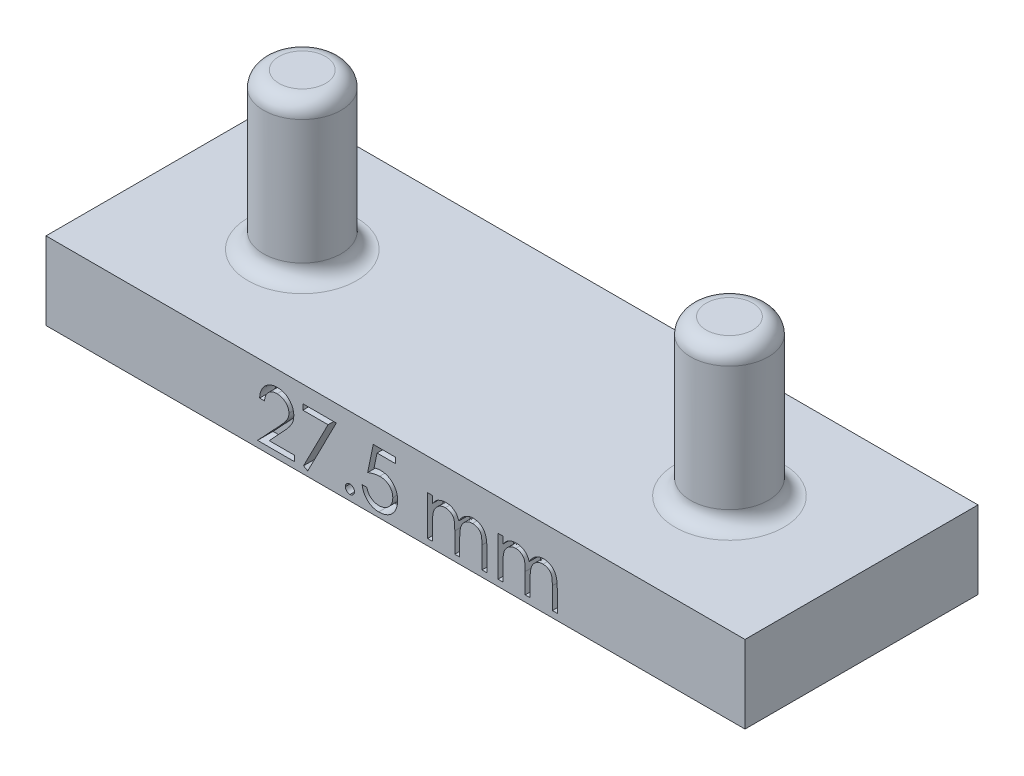
from build123d import *

# Parameters (mm, degrees)
SKETCH1_R             = 2.5
BOSS_EXTRUDE1_DEPTH   = 10
BOSS_EXTRUDE1_2_DEPTH = 10
SKETCH2_W             = 45
SKETCH2_H             = 15
BOSS_EXTRUDE2_DEPTH   = 5
CUT_EXTRUDE1_DEPTH    = 1
FILLET1_R             = 1


with BuildPart() as part:
    # Sketch1 → Boss-Extrude1 (new body)
    with BuildSketch(Plane(origin=(0, 0, 0), x_dir=(1, 0, 0), z_dir=(0, 1, 0))):
        with Locations(Location((-41.821276596, 3.10212766, 0), (0, 0, 270))):
            Circle(SKETCH1_R)
    extrude(amount=BOSS_EXTRUDE1_DEPTH)



with BuildPart() as body_2:
    # Sketch1 → Boss-Extrude1 2 (new body)
    with BuildSketch(Plane(origin=(0, 0, 0), x_dir=(1, 0, 0), z_dir=(0, 1, 0))):
        with Locations(Location((-14.321276596, 3.10212766, 0), (0, 0, 270))):
            Circle(SKETCH1_R)
    extrude(amount=BOSS_EXTRUDE1_2_DEPTH)


with BuildPart() as part_1:
    add(part.part)

    add(body_2.part)  # Boss-Extrude2 merges body 2
    # Sketch2 → Boss-Extrude2 (add)
    with BuildSketch(Plane.XZ):
        with Locations((-28.321276596, -3.10212766)):
            Rectangle(SKETCH2_W, SKETCH2_H)
    extrude(amount=BOSS_EXTRUDE2_DEPTH)

    # Sketch3 → Cut-Extrude1 (cut)
    with BuildSketch(Plane.XY.offset(4.39787234)):
        with BuildLine():
            Line((-21.721415096, -2.034062219), (-21.407312532, -2.034062219))
            Line((-21.407312532, -2.034062219), (-21.407312532, -2.478573436))
            add(Edge.make_bspline(
                [(-21.407312532, -2.478573436), (-21.379028582, -2.439685835), (-21.324833822, -2.365173462), (-21.23596817, -2.266983177), (-21.147192057, -2.183655023), (-21.083258676, -2.139912151), (-21.052544904, -2.118897956)],
                knots=[0, 0, 0, 0, 1.134379233, 2.173579362, 3.122582517, 4, 4, 4, 4], degree=3))
            add(Edge.make_bspline(
                [(-21.052544904, -2.118897956), (-21.010680241, -2.09889259), (-20.927682342, -2.059231377), (-20.796263117, -2.018997818), (-20.661788447, -1.994272717), (-20.570980233, -1.990891343), (-20.525301314, -1.989190424)],
                knots=[0, 0, 0, 0, 1.014936303, 2.012140481, 3.000054389, 4, 4, 4, 4], degree=3))
            add(Edge.make_bspline(
                [(-20.525301314, -1.989190424), (-20.494408317, -1.990235714), (-20.433272738, -1.992304289), (-20.342688648, -2.005764324), (-20.254830036, -2.029030497), (-20.170216007, -2.061437821), (-20.090495328, -2.100684508), (-20.01740613, -2.146734216), (-19.951781922, -2.198431291), (-19.893655871, -2.258110224), (-19.841386845, -2.327446823), (-19.793307998, -2.408311072), (-19.748882786, -2.502518733), (-19.724261477, -2.570885274), (-19.71129891, -2.606878725)],
                knots=[0, 0, 0, 0, 1.009824226, 1.998387844, 2.986035974, 3.974953746, 4.955485308, 5.885931332, 6.793869504, 7.679848016, 8.601185859, 9.625726857, 10.749998409, 12, 12, 12, 12], degree=3))
            add(Edge.make_bspline(
                [(-19.71129891, -2.606878725), (-19.697587659, -2.582154306), (-19.670605842, -2.533500121), (-19.625300205, -2.464641858), (-19.577832408, -2.400235067), (-19.527797915, -2.340228642), (-19.475373328, -2.284918912), (-19.420311928, -2.23412301), (-19.362927146, -2.187622797), (-19.283134906, -2.133299637), (-19.179322299, -2.075598456), (-19.048434184, -2.025570012), (-18.912284013, -1.994653883), (-18.819866315, -1.99102361), (-18.773197949, -1.989190424)],
                knots=[0, 0, 0, 0, 0.86119277, 1.694706429, 2.50939023, 3.298075842, 4.073795165, 4.829715201, 5.57930267, 6.321991688, 7.768977793, 9.186738141, 10.579381044, 12, 12, 12, 12], degree=3))
            add(Edge.make_bspline(
                [(-18.773197949, -1.989190424), (-18.730316486, -1.990807645), (-18.646393299, -1.993972703), (-18.524216034, -2.018826176), (-18.410274228, -2.061503823), (-18.304797152, -2.11973746), (-18.209637339, -2.192916643), (-18.12692103, -2.279985481), (-18.057150666, -2.380328104), (-18.011572027, -2.474720092), (-17.980656762, -2.558055425), (-17.961595528, -2.629061717), (-17.944755833, -2.707213269), (-17.930774588, -2.792603531), (-17.920556036, -2.885534139), (-17.91298532, -2.985853015), (-17.907861247, -3.093638127), (-17.907499174, -3.168003627), (-17.907312532, -3.20633786)],
                knots=[0, 0, 0, 0, 1.209669288, 2.367440248, 3.500751976, 4.631527125, 5.755587489, 6.87532382, 8.007944318, 9.190864318, 9.82315674, 10.514484317, 11.263564316, 12.079023757, 12.955305781, 13.901327259, 14.918167583, 16, 16, 16, 16], degree=3))
            Line((-17.907312532, -3.20633786), (-17.907312532, -4.591754526))
            Line((-17.907312532, -4.591754526), (-18.221415096, -4.591754526))
            Line((-18.221415096, -4.591754526), (-18.221415096, -3.204935616))
            add(Edge.make_bspline(
                [(-18.221415096, -3.204935616), (-18.221492979, -3.172215042), (-18.221642658, -3.109331075), (-18.22433629, -3.019078624), (-18.229411604, -2.936810267), (-18.235346243, -2.862638179), (-18.243590052, -2.79638939), (-18.254235984, -2.738196972), (-18.265513664, -2.68760316), (-18.284249655, -2.631517113), (-18.314197546, -2.569646902), (-18.359815026, -2.502923326), (-18.417285133, -2.444842526), (-18.483645289, -2.394424209), (-18.559193734, -2.353430568), (-18.642458457, -2.324154558), (-18.732922509, -2.30603168), (-18.795545297, -2.304225665), (-18.827885449, -2.303292988)],
                knots=[0, 0, 0, 0, 1.253487763, 2.409012846, 3.458416907, 4.410876679, 5.259312806, 6.014470957, 6.676830364, 7.243083969, 8.276244668, 9.299465089, 10.325150304, 11.392391894, 12.482080715, 13.603491619, 14.762376348, 16, 16, 16, 16], degree=3))
            add(Edge.make_bspline(
                [(-18.827885449, -2.303292988), (-18.867555403, -2.304709145), (-18.945958314, -2.307508011), (-19.0604038, -2.336081884), (-19.170374817, -2.379162134), (-19.27258995, -2.441594591), (-19.36661774, -2.516402955), (-19.447517318, -2.605352551), (-19.514349504, -2.705982478), (-19.55960348, -2.79912918), (-19.588192781, -2.882798624), (-19.607069697, -2.955895996), (-19.621753088, -3.038977564), (-19.635523617, -3.131485055), (-19.644511345, -3.234055235), (-19.652679718, -3.346213636), (-19.656500581, -3.468297596), (-19.657035039, -3.552924284), (-19.657312532, -3.596862699)],
                knots=[0, 0, 0, 0, 1.090531906, 2.155305635, 3.229839962, 4.33261226, 5.44038871, 6.529323825, 7.629011124, 8.757537029, 9.370236727, 10.061839251, 10.834451254, 11.692844982, 12.636905849, 13.66920014, 14.789842145, 16, 16, 16, 16], degree=3))
            Line((-19.657312532, -3.596862699), (-19.657312532, -4.591754526))
            Line((-19.657312532, -4.591754526), (-19.971415096, -4.591754526))
            Line((-19.971415096, -4.591754526), (-19.971415096, -3.291173597))
            add(Edge.make_bspline(
                [(-19.971415096, -3.291173597), (-19.971494527, -3.254480278), (-19.971647344, -3.183886021), (-19.974323661, -3.082652345), (-19.979410283, -2.990571265), (-19.985290832, -2.907749802), (-19.99375101, -2.834338473), (-20.003360772, -2.769943715), (-20.014709383, -2.714726964), (-20.033499267, -2.654163579), (-20.062213736, -2.587442656), (-20.108401998, -2.516301635), (-20.166009578, -2.454033537), (-20.233580454, -2.400874789), (-20.309586136, -2.356933307), (-20.393569537, -2.325273556), (-20.48477445, -2.306849266), (-20.547652156, -2.304500769), (-20.579988814, -2.303292988)],
                knots=[0, 0, 0, 0, 1.320475261, 2.540461679, 3.643808994, 4.639130445, 5.527981419, 6.302341397, 6.981980563, 7.553956391, 8.582137848, 9.585246428, 10.591171744, 11.620968678, 12.668337649, 13.738356861, 14.836885341, 16, 16, 16, 16], degree=3))
            add(Edge.make_bspline(
                [(-20.579988814, -2.303292988), (-20.618005025, -2.304823448), (-20.693769985, -2.3078736), (-20.805071954, -2.335327874), (-20.912557638, -2.378331949), (-21.014512337, -2.437991768), (-21.108186485, -2.511890847), (-21.190194752, -2.598805742), (-21.259137278, -2.697654776), (-21.304869093, -2.789819292), (-21.334367567, -2.871392567), (-21.353962902, -2.940743515), (-21.370802527, -3.017743763), (-21.383316549, -3.102630874), (-21.395396965, -3.194851968), (-21.401227274, -3.294866458), (-21.406898836, -3.402588546), (-21.407171251, -3.476961091), (-21.407312532, -3.515532571)],
                knots=[0, 0, 0, 0, 1.098833095, 2.189935336, 3.297829714, 4.440610912, 5.596351641, 6.740013378, 7.886572111, 9.072425424, 9.705826452, 10.395263256, 11.156850408, 11.985370555, 12.878090359, 13.847760091, 14.883794034, 16, 16, 16, 16], degree=3))
            Line((-21.407312532, -3.515532571), (-21.407312532, -4.591754526))
            Line((-21.407312532, -4.591754526), (-21.721415096, -4.591754526))
            Line((-21.721415096, -4.591754526), (-21.721415096, -2.034062219))
        make_face()
        with BuildLine():
            Line((-26.253466378, -2.034062219), (-25.939363814, -2.034062219))
            Line((-25.939363814, -2.034062219), (-25.939363814, -2.478573436))
            add(Edge.make_bspline(
                [(-25.939363814, -2.478573436), (-25.911079864, -2.439685835), (-25.856885104, -2.365173462), (-25.768019452, -2.266983177), (-25.679243339, -2.183655023), (-25.615309958, -2.139912151), (-25.584596186, -2.118897956)],
                knots=[0, 0, 0, 0, 1.134379233, 2.173579362, 3.122582517, 4, 4, 4, 4], degree=3))
            add(Edge.make_bspline(
                [(-25.584596186, -2.118897956), (-25.542731524, -2.09889259), (-25.459733624, -2.059231377), (-25.328314399, -2.018997818), (-25.193839729, -1.994272717), (-25.103031515, -1.990891343), (-25.057352596, -1.989190424)],
                knots=[0, 0, 0, 0, 1.014936303, 2.012140481, 3.000054389, 4, 4, 4, 4], degree=3))
            add(Edge.make_bspline(
                [(-25.057352596, -1.989190424), (-25.026459599, -1.990235714), (-24.96532402, -1.992304289), (-24.87473993, -2.005764324), (-24.786881318, -2.029030497), (-24.702267289, -2.061437821), (-24.62254661, -2.100684508), (-24.549457412, -2.146734216), (-24.483833204, -2.198431291), (-24.425707153, -2.258110224), (-24.373438127, -2.327446823), (-24.325359281, -2.408311072), (-24.280934068, -2.502518733), (-24.256312759, -2.570885274), (-24.243350192, -2.606878725)],
                knots=[0, 0, 0, 0, 1.009824226, 1.998387844, 2.986035974, 3.974953746, 4.955485308, 5.885931332, 6.793869504, 7.679848016, 8.601185859, 9.625726857, 10.749998409, 12, 12, 12, 12], degree=3))
            add(Edge.make_bspline(
                [(-24.243350192, -2.606878725), (-24.229638941, -2.582154306), (-24.202657124, -2.533500121), (-24.157351487, -2.464641858), (-24.10988369, -2.400235067), (-24.059849197, -2.340228642), (-24.00742461, -2.284918912), (-23.95236321, -2.23412301), (-23.894978428, -2.187622797), (-23.815186189, -2.133299637), (-23.711373581, -2.075598456), (-23.580485466, -2.025570012), (-23.444335295, -1.994653883), (-23.351917597, -1.99102361), (-23.305249231, -1.989190424)],
                knots=[0, 0, 0, 0, 0.86119277, 1.694706429, 2.50939023, 3.298075842, 4.073795165, 4.829715201, 5.57930267, 6.321991688, 7.768977793, 9.186738141, 10.579381044, 12, 12, 12, 12], degree=3))
            add(Edge.make_bspline(
                [(-23.305249231, -1.989190424), (-23.262367768, -1.990807645), (-23.178444581, -1.993972703), (-23.056267316, -2.018826176), (-22.94232551, -2.061503823), (-22.836848434, -2.11973746), (-22.741688621, -2.192916643), (-22.658972312, -2.279985481), (-22.589201948, -2.380328104), (-22.543623309, -2.474720092), (-22.512708044, -2.558055425), (-22.49364681, -2.629061717), (-22.476807115, -2.707213269), (-22.46282587, -2.792603531), (-22.452607318, -2.885534139), (-22.445036602, -2.985853015), (-22.439912529, -3.093638127), (-22.439550456, -3.168003627), (-22.439363814, -3.20633786)],
                knots=[0, 0, 0, 0, 1.209669288, 2.367440248, 3.500751976, 4.631527125, 5.755587489, 6.87532382, 8.007944318, 9.190864318, 9.82315674, 10.514484317, 11.263564316, 12.079023757, 12.955305781, 13.901327259, 14.918167583, 16, 16, 16, 16], degree=3))
            Line((-22.439363814, -3.20633786), (-22.439363814, -4.591754526))
            Line((-22.439363814, -4.591754526), (-22.753466378, -4.591754526))
            Line((-22.753466378, -4.591754526), (-22.753466378, -3.204935616))
            add(Edge.make_bspline(
                [(-22.753466378, -3.204935616), (-22.753544261, -3.172215042), (-22.75369394, -3.109331075), (-22.756387572, -3.019078624), (-22.761462886, -2.936810267), (-22.767397525, -2.862638179), (-22.775641334, -2.79638939), (-22.786287266, -2.738196972), (-22.797564946, -2.68760316), (-22.816300937, -2.631517113), (-22.846248828, -2.569646902), (-22.891866308, -2.502923326), (-22.949336415, -2.444842526), (-23.015696571, -2.394424209), (-23.091245016, -2.353430568), (-23.174509739, -2.324154558), (-23.264973791, -2.30603168), (-23.327596579, -2.304225665), (-23.359936731, -2.303292988)],
                knots=[0, 0, 0, 0, 1.253487763, 2.409012846, 3.458416907, 4.410876679, 5.259312806, 6.014470957, 6.676830364, 7.243083969, 8.276244668, 9.299465089, 10.325150304, 11.392391894, 12.482080715, 13.603491619, 14.762376348, 16, 16, 16, 16], degree=3))
            add(Edge.make_bspline(
                [(-23.359936731, -2.303292988), (-23.399606685, -2.304709145), (-23.478009596, -2.307508011), (-23.592455082, -2.336081884), (-23.702426099, -2.379162134), (-23.804641232, -2.441594591), (-23.898669022, -2.516402955), (-23.9795686, -2.605352551), (-24.046400786, -2.705982478), (-24.091654762, -2.79912918), (-24.120244063, -2.882798624), (-24.139120979, -2.955895996), (-24.15380437, -3.038977564), (-24.1675749, -3.131485055), (-24.176562628, -3.234055235), (-24.184731, -3.346213636), (-24.188551863, -3.468297596), (-24.189086321, -3.552924284), (-24.189363814, -3.596862699)],
                knots=[0, 0, 0, 0, 1.090531906, 2.155305635, 3.229839962, 4.33261226, 5.44038871, 6.529323825, 7.629011124, 8.757537029, 9.370236727, 10.061839251, 10.834451254, 11.692844982, 12.636905849, 13.66920014, 14.789842145, 16, 16, 16, 16], degree=3))
            Line((-24.189363814, -3.596862699), (-24.189363814, -4.591754526))
            Line((-24.189363814, -4.591754526), (-24.503466378, -4.591754526))
            Line((-24.503466378, -4.591754526), (-24.503466378, -3.291173597))
            add(Edge.make_bspline(
                [(-24.503466378, -3.291173597), (-24.503545809, -3.254480278), (-24.503698626, -3.183886021), (-24.506374944, -3.082652345), (-24.511461565, -2.990571265), (-24.517342114, -2.907749802), (-24.525802292, -2.834338473), (-24.535412054, -2.769943715), (-24.546760665, -2.714726964), (-24.565550549, -2.654163579), (-24.594265018, -2.587442656), (-24.64045328, -2.516301635), (-24.69806086, -2.454033537), (-24.765631736, -2.400874789), (-24.841637418, -2.356933307), (-24.925620819, -2.325273556), (-25.016825732, -2.306849266), (-25.079703438, -2.304500769), (-25.112040096, -2.303292988)],
                knots=[0, 0, 0, 0, 1.320475261, 2.540461679, 3.643808994, 4.639130445, 5.527981419, 6.302341397, 6.981980563, 7.553956391, 8.582137848, 9.585246428, 10.591171744, 11.620968678, 12.668337649, 13.738356861, 14.836885341, 16, 16, 16, 16], degree=3))
            add(Edge.make_bspline(
                [(-25.112040096, -2.303292988), (-25.150056307, -2.304823448), (-25.225821267, -2.3078736), (-25.337123236, -2.335327874), (-25.44460892, -2.378331949), (-25.546563619, -2.437991768), (-25.640237767, -2.511890847), (-25.722246034, -2.598805742), (-25.79118856, -2.697654776), (-25.836920375, -2.789819292), (-25.866418849, -2.871392567), (-25.886014184, -2.940743515), (-25.90285381, -3.017743763), (-25.915367831, -3.102630874), (-25.927448247, -3.194851968), (-25.933278556, -3.294866458), (-25.938950118, -3.402588546), (-25.939222533, -3.476961091), (-25.939363814, -3.515532571)],
                knots=[0, 0, 0, 0, 1.098833095, 2.189935336, 3.297829714, 4.440610912, 5.596351641, 6.740013378, 7.886572111, 9.072425424, 9.705826452, 10.395263256, 11.156850408, 11.985370555, 12.878090359, 13.847760091, 14.883794034, 16, 16, 16, 16], degree=3))
            Line((-25.939363814, -3.515532571), (-25.939363814, -4.591754526))
            Line((-25.939363814, -4.591754526), (-26.253466378, -4.591754526))
            Line((-26.253466378, -4.591754526), (-26.253466378, -2.034062219))
        make_face()
        with BuildLine():
            Line((-28.317568942, -1.091754526), (-28.317568942, -1.450728885))
            Line((-28.317568942, -1.450728885), (-29.50807375, -1.450728885))
            Line((-29.50807375, -1.450728885), (-29.696675513, -2.371301802))
            add(Edge.make_bspline(
                [(-29.696675513, -2.371301802), (-29.659619638, -2.36107153), (-29.587829742, -2.341251996), (-29.481869881, -2.319246226), (-29.381277678, -2.305980782), (-29.316002308, -2.304169471), (-29.284415897, -2.303292988)],
                knots=[0, 0, 0, 0, 1.100273476, 2.13160584, 3.095893838, 4, 4, 4, 4], degree=3))
            add(Edge.make_bspline(
                [(-29.284415897, -2.303292988), (-29.245332158, -2.304138923), (-29.16848376, -2.305802244), (-29.056044813, -2.321774094), (-28.94871192, -2.346914008), (-28.84670955, -2.38203453), (-28.749848999, -2.426944263), (-28.659021438, -2.483044204), (-28.572863525, -2.548577535), (-28.492920931, -2.623922547), (-28.420396623, -2.706844164), (-28.356630633, -2.796002035), (-28.302468043, -2.890529697), (-28.258907288, -2.991330306), (-28.224122953, -3.097289459), (-28.200970959, -3.209522042), (-28.18555425, -3.326970162), (-28.183831863, -3.407274732), (-28.182953557, -3.448224879)],
                knots=[0, 0, 0, 0, 1.052922333, 2.070308379, 3.05430497, 4.020497103, 4.973039431, 5.925935799, 6.892292201, 7.88610001, 8.88166317, 9.857072816, 10.836096531, 11.812156883, 12.81219415, 13.836441305, 14.89672472, 16, 16, 16, 16], degree=3))
            add(Edge.make_bspline(
                [(-28.182953557, -3.448224879), (-28.183618633, -3.476747099), (-28.184939795, -3.533406087), (-28.191658383, -3.617550287), (-28.204594099, -3.69991312), (-28.221961823, -3.780505512), (-28.244504241, -3.859174885), (-28.271793295, -3.936146412), (-28.305189323, -4.010941019), (-28.341820698, -4.084266414), (-28.383067176, -4.154464921), (-28.428845683, -4.220113908), (-28.477211174, -4.282198189), (-28.52925256, -4.340051922), (-28.585453555, -4.39329494), (-28.645133522, -4.442243222), (-28.707816241, -4.487724552), (-28.774471483, -4.527892747), (-28.843613966, -4.564855703), (-28.916242183, -4.595179241), (-28.990702884, -4.622289769), (-29.068067759, -4.643899296), (-29.148161572, -4.660831851), (-29.231116347, -4.672332452), (-29.316497018, -4.680708889), (-29.37437203, -4.681233246), (-29.403606602, -4.681498116)],
                knots=[0, 0, 0, 0, 1.056347294, 2.098418968, 3.122841568, 4.141288669, 5.149314143, 6.15115421, 7.162517403, 8.180376062, 9.185164535, 10.17417709, 11.141909838, 12.097768115, 13.052685741, 14.0056014, 14.954263652, 15.917497458, 16.885230207, 17.854509472, 18.828990115, 19.81800267, 20.826176721, 21.857883937, 22.917946725, 24, 24, 24, 24], degree=3))
            add(Edge.make_bspline(
                [(-29.403606602, -4.681498116), (-29.438480783, -4.680807278), (-29.507091614, -4.679448136), (-29.607612181, -4.665229651), (-29.704326787, -4.644865734), (-29.796456888, -4.614229464), (-29.884828151, -4.57584217), (-29.968250869, -4.527325998), (-30.048856645, -4.472346894), (-30.123368682, -4.407466541), (-30.192524795, -4.336550859), (-30.254431304, -4.259593218), (-30.309564881, -4.177863776), (-30.357042628, -4.090965622), (-30.397540649, -3.999127091), (-30.429355638, -3.90200409), (-30.455033993, -3.800104086), (-30.465897413, -3.729950576), (-30.471415096, -3.694318629)],
                knots=[0, 0, 0, 0, 1.0467383, 2.05933395, 3.04377827, 4.011590433, 4.970194871, 5.932262533, 6.905835911, 7.896367577, 8.894135286, 9.877477877, 10.858688626, 11.851381753, 12.8477658, 13.868841284, 14.917554742, 16, 16, 16, 16], degree=3))
            Line((-30.471415096, -3.694318629), (-30.157312532, -3.694318629))
            add(Edge.make_bspline(
                [(-30.157312532, -3.694318629), (-30.149583974, -3.727695081), (-30.134729258, -3.791846476), (-30.102123509, -3.881977817), (-30.062257634, -3.962297041), (-30.014853285, -4.033866624), (-29.958303255, -4.096275622), (-29.893773826, -4.151892684), (-29.821426103, -4.202067813), (-29.741032873, -4.24389058), (-29.656219794, -4.279559334), (-29.567452584, -4.303311028), (-29.477148237, -4.320011921), (-29.416069867, -4.321683682), (-29.385377436, -4.322523757)],
                knots=[0, 0, 0, 0, 1.136247022, 2.183929868, 3.172523383, 4.106158343, 5.02341133, 5.958108904, 6.928429099, 7.938127109, 8.96079061, 9.975095812, 10.982467395, 12, 12, 12, 12], degree=3))
            add(Edge.make_bspline(
                [(-29.385377436, -4.322523757), (-29.355418991, -4.321702979), (-29.296430569, -4.320086861), (-29.209619182, -4.307647849), (-29.125806308, -4.288490277), (-29.045818951, -4.259820422), (-28.968257412, -4.224975704), (-28.895083641, -4.180260628), (-28.824180764, -4.12880061), (-28.757752631, -4.06984398), (-28.696913182, -4.004874285), (-28.64315706, -3.935396892), (-28.598380147, -3.861280045), (-28.560646038, -3.783806892), (-28.531992739, -3.702128335), (-28.511551758, -3.61662716), (-28.499548699, -3.52709218), (-28.497897519, -3.46602287), (-28.497056122, -3.434903565)],
                knots=[0, 0, 0, 0, 1.027316725, 2.022795036, 3.002884548, 3.971462791, 4.93288096, 5.914575861, 6.907176829, 7.935150275, 8.956128384, 9.956726525, 10.942570165, 11.921478529, 12.907843606, 13.90538589, 14.932640048, 16, 16, 16, 16], degree=3))
            add(Edge.make_bspline(
                [(-28.497056122, -3.434903565), (-28.497714601, -3.406827813), (-28.499003481, -3.351873524), (-28.509534051, -3.271474318), (-28.527851024, -3.195401275), (-28.553274904, -3.123287041), (-28.585554411, -3.055063599), (-28.625000724, -2.990660539), (-28.672354122, -2.930926706), (-28.72644601, -2.875834152), (-28.785704051, -2.824989277), (-28.851147794, -2.781645191), (-28.92140772, -2.745181273), (-28.99563732, -2.713713275), (-29.075602218, -2.691112529), (-29.159718851, -2.674144644), (-29.248895559, -2.664329281), (-29.309866247, -2.662967393), (-29.341206763, -2.662267347)],
                knots=[0, 0, 0, 0, 1.045622112, 2.046656509, 3.013763289, 3.955457236, 4.890082067, 5.820317437, 6.762574623, 7.722996705, 8.69280354, 9.665887285, 10.63943826, 11.638615906, 12.663482002, 13.728887084, 14.832589034, 16, 16, 16, 16], degree=3))
            add(Edge.make_bspline(
                [(-29.341206763, -2.662267347), (-29.368335691, -2.662847938), (-29.424350047, -2.664046711), (-29.510272873, -2.672873208), (-29.600564596, -2.687112503), (-29.694879092, -2.70669875), (-29.7934996, -2.732329827), (-29.896218001, -2.763044327), (-30.003250267, -2.799766326), (-30.075367992, -2.82749854), (-30.112440737, -2.841754526)],
                knots=[0, 0, 0, 0, 0.817624296, 1.688186739, 2.600797293, 3.572016777, 4.590301741, 5.671205678, 6.80286297, 8, 8, 8, 8], degree=3))
            Line((-30.112440737, -2.841754526), (-29.753466378, -1.091754526))
            Line((-29.753466378, -1.091754526), (-28.317568942, -1.091754526))
        make_face()
        with BuildLine():
            add(Edge.make_bspline(
                [(-31.256671506, -4.053292988), (-31.237181294, -4.054451154), (-31.198973012, -4.056721605), (-31.143733883, -4.072298279), (-31.093739224, -4.099956939), (-31.049206979, -4.136819717), (-31.012500502, -4.181515381), (-30.98385615, -4.231111289), (-30.968415165, -4.286812882), (-30.966161253, -4.325242557), (-30.96500484, -4.344959654)],
                knots=[0, 0, 0, 0, 1.020151414, 1.999887582, 2.974338812, 3.990962822, 5.007586832, 5.987933904, 6.967670073, 8, 8, 8, 8], degree=3))
            add(Edge.make_bspline(
                [(-30.96500484, -4.344959654), (-30.96620044, -4.364202984), (-30.968558147, -4.402150548), (-30.983820756, -4.457432011), (-31.012718806, -4.507058915), (-31.048953799, -4.552361053), (-31.093750232, -4.589301924), (-31.143852079, -4.616725268), (-31.198843337, -4.633417248), (-31.23715966, -4.635543545), (-31.256671506, -4.636626321)],
                knots=[0, 0, 0, 0, 1.009421747, 1.99056486, 2.972319754, 3.999869655, 5.017953583, 5.993804169, 6.978383603, 8, 8, 8, 8], degree=3))
            add(Edge.make_bspline(
                [(-31.256671506, -4.636626321), (-31.276197412, -4.635582724), (-31.314317094, -4.633545349), (-31.369103089, -4.616382543), (-31.419510057, -4.589559082), (-31.464297769, -4.552292173), (-31.500836241, -4.507292029), (-31.528461623, -4.457090233), (-31.545051772, -4.402308796), (-31.547233645, -4.364234153), (-31.548338173, -4.344959654)],
                knots=[0, 0, 0, 0, 1.022052826, 1.995314843, 2.982371812, 4.00089066, 5.028879526, 6.005146991, 6.990147033, 8, 8, 8, 8], degree=3))
            add(Edge.make_bspline(
                [(-31.548338173, -4.344959654), (-31.547276074, -4.325210275), (-31.545202455, -4.286652035), (-31.528426795, -4.231452927), (-31.501050583, -4.181284488), (-31.464045188, -4.136887908), (-31.419520892, -4.099700605), (-31.369224687, -4.072635812), (-31.314185147, -4.0565954), (-31.276175208, -4.054412883), (-31.256671506, -4.053292988)],
                knots=[0, 0, 0, 0, 1.032775665, 2.016367738, 2.991239715, 4.008302682, 5.025365648, 6.011011707, 6.979408107, 8, 8, 8, 8], degree=3))
        make_face()
        Polygon((-34.28551766, -1.091754526), (-32.131671506, -1.091754526), (-33.971415096, -4.681498116), (-34.242749231, -4.532159174), (-32.663121827, -1.450728885), (-34.28551766, -1.450728885), align=None)
        with BuildLine():
            Line((-36.753466378, -2.168677603), (-37.067568942, -2.168677603))
            add(Edge.make_bspline(
                [(-37.067568942, -2.168677603), (-37.065521789, -2.127006715), (-37.061501235, -2.045166201), (-37.042672946, -1.925842294), (-37.015732069, -1.811787496), (-36.977640615, -1.703917582), (-36.930334337, -1.601278774), (-36.873604309, -1.504278759), (-36.806410459, -1.41328757), (-36.730203725, -1.329148727), (-36.647435086, -1.251961156), (-36.558129146, -1.185305913), (-36.464284119, -1.128988242), (-36.36618472, -1.081907), (-36.262724157, -1.046567154), (-36.154841299, -1.020345514), (-36.042062162, -1.004569169), (-35.96522214, -1.002873383), (-35.92614266, -1.002010936)],
                knots=[0, 0, 0, 0, 1.10065271, 2.161652631, 3.183658789, 4.190468796, 5.17591951, 6.163126047, 7.15150782, 8.156236427, 9.156009102, 10.134482811, 11.092018607, 12.041330605, 13.001268258, 13.972401359, 14.968799086, 16, 16, 16, 16], degree=3))
            add(Edge.make_bspline(
                [(-35.92614266, -1.002010936), (-35.887764586, -1.002909393), (-35.812353041, -1.004674828), (-35.702291027, -1.019835857), (-35.597513732, -1.043581449), (-35.498225966, -1.076896865), (-35.405219901, -1.121681292), (-35.317796857, -1.175478831), (-35.234916046, -1.237698662), (-35.160309262, -1.310952476), (-35.091801183, -1.38915486), (-35.032698928, -1.472642764), (-34.982085764, -1.55887205), (-34.939898085, -1.648500251), (-34.908841946, -1.74237128), (-34.885263738, -1.839118482), (-34.871936324, -1.939743293), (-34.8698909, -2.007849849), (-34.868850993, -2.04247568)],
                knots=[0, 0, 0, 0, 1.111607364, 2.184268762, 3.212621178, 4.221274766, 5.211760367, 6.196651075, 7.1921475, 8.207485113, 9.220403448, 10.201281604, 11.166441695, 12.114753415, 13.065576456, 14.026450734, 14.996634279, 16, 16, 16, 16], degree=3))
            add(Edge.make_bspline(
                [(-34.868850993, -2.04247568), (-34.870544256, -2.091223515), (-34.873901068, -2.187863728), (-34.902615444, -2.329878591), (-34.947461955, -2.46747201), (-35.001459312, -2.578209312), (-35.055931756, -2.667442806), (-35.105019264, -2.740911511), (-35.162484075, -2.820016979), (-35.229162573, -2.904494317), (-35.303675445, -2.995005222), (-35.386697608, -3.091495017), (-35.47882109, -3.192966787), (-35.543479591, -3.262272388), (-35.576984006, -3.298184815)],
                knots=[0, 0, 0, 0, 1.184426356, 2.348067706, 3.509069118, 4.696110526, 5.333549288, 6.050745305, 6.844228056, 7.710549037, 8.667450064, 9.695053472, 10.805634456, 12, 12, 12, 12], degree=3))
            Line((-35.576984006, -3.298184815), (-36.452685128, -4.232780167))
            Line((-36.452685128, -4.232780167), (-34.823979199, -4.232780167))
            Line((-34.823979199, -4.232780167), (-34.823979199, -4.591754526))
            Line((-34.823979199, -4.591754526), (-37.202184327, -4.591754526))
            Line((-37.202184327, -4.591754526), (-35.844812532, -3.143236898))
            add(Edge.make_bspline(
                [(-35.844812532, -3.143236898), (-35.811764645, -3.108738591), (-35.748286418, -3.042474405), (-35.658503841, -2.945731445), (-35.577864853, -2.855981904), (-35.50584746, -2.773395356), (-35.444013955, -2.696763788), (-35.389141723, -2.628569084), (-35.345176132, -2.565814634), (-35.297460736, -2.49307402), (-35.251246755, -2.404261703), (-35.211534399, -2.295728014), (-35.18731955, -2.184000761), (-35.184414715, -2.108498724), (-35.182953557, -2.070520552)],
                knots=[0, 0, 0, 0, 1.329631726, 2.553950428, 3.673215718, 4.687767853, 5.603093632, 6.413772471, 7.123043292, 7.734684054, 8.834405432, 9.900288307, 10.943827018, 12, 12, 12, 12], degree=3))
            add(Edge.make_bspline(
                [(-35.182953557, -2.070520552), (-35.1835893, -2.046639153), (-35.184842226, -1.999573503), (-35.195899923, -1.930567744), (-35.212610429, -1.86400293), (-35.236555687, -1.799674311), (-35.268162428, -1.738228659), (-35.306635807, -1.679591179), (-35.351025871, -1.622902214), (-35.40237714, -1.569748916), (-35.45878866, -1.52106771), (-35.51838291, -1.477943625), (-35.581433014, -1.441904514), (-35.647673136, -1.412361017), (-35.716918605, -1.389185636), (-35.789303351, -1.373127056), (-35.864627367, -1.363044572), (-35.916060862, -1.3616804), (-35.942268461, -1.360985295)],
                knots=[0, 0, 0, 0, 0.991446411, 1.95395049, 2.89581595, 3.838931463, 4.798493298, 5.75982156, 6.748411868, 7.785213223, 8.824556874, 9.840280684, 10.836137867, 11.835679398, 12.848801643, 13.863922112, 14.911575587, 16, 16, 16, 16], degree=3))
            add(Edge.make_bspline(
                [(-35.942268461, -1.360985295), (-35.969639294, -1.361700328), (-36.02339109, -1.363104533), (-36.102310123, -1.372927197), (-36.177595901, -1.389873037), (-36.249437804, -1.413049712), (-36.31795739, -1.442508261), (-36.382821434, -1.479200005), (-36.443884323, -1.522983498), (-36.501260846, -1.572624055), (-36.554124825, -1.627891656), (-36.600571701, -1.689501619), (-36.641155715, -1.756329034), (-36.676564949, -1.828193585), (-36.705320639, -1.905747365), (-36.727293789, -1.98871507), (-36.744680636, -2.076736451), (-36.750489157, -2.137521536), (-36.753466378, -2.168677603)],
                knots=[0, 0, 0, 0, 1.031018746, 2.02475058, 2.990194455, 3.934040569, 4.864654155, 5.795059489, 6.735614925, 7.690564532, 8.649604399, 9.611025574, 10.590972636, 11.591080095, 12.624614302, 13.701020113, 14.821632451, 16, 16, 16, 16], degree=3))
        make_face()
    extrude(amount=-CUT_EXTRUDE1_DEPTH, mode=Mode.SUBTRACT)

    # Fillet1
    fillet1_edges = [part_1.edges().sort_by_distance(p)[0] for p in [
        (-14.321276596, 0, -5.60212766),
        (-14.321276596, 10, -5.60212766),
        (-41.821276596, 10, -5.60212766),
        (-41.821276596, 0, -5.60212766),
    ]]
    fillet(fillet1_edges, radius=FILLET1_R)


solid = part_1.part
